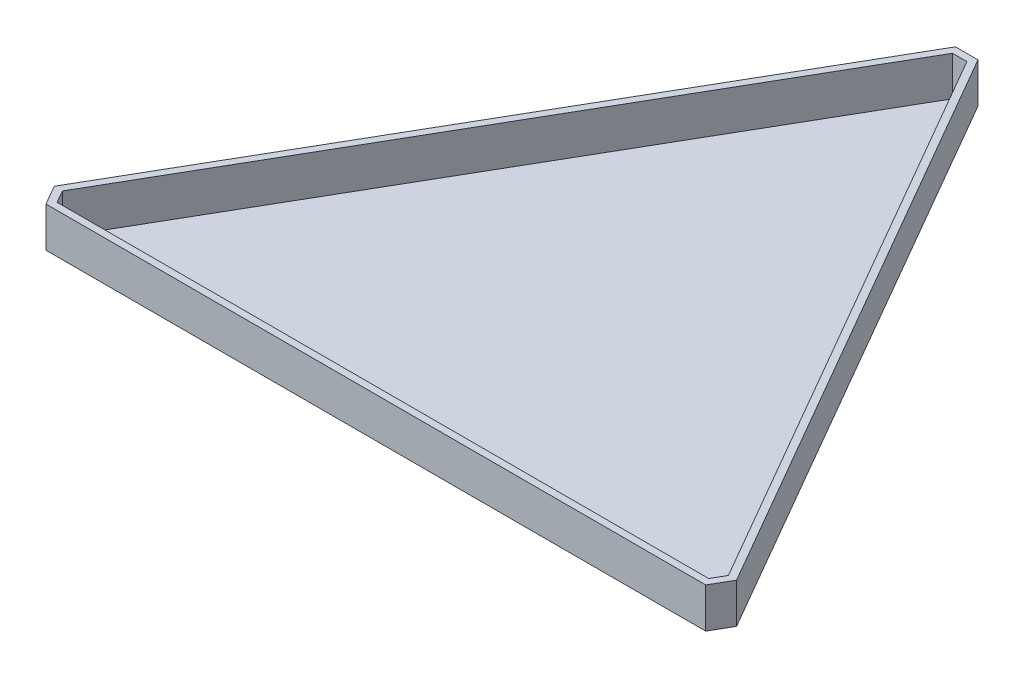
from build123d import *

# Parameters (mm, degrees)
BOSS_EXTRUDE6_DEPTH = 0.2
BOSS_EXTRUDE8_DEPTH = 14.2


with BuildPart() as part:
    # Sketch1 → Boss-Extrude6 (new body)
    with BuildSketch(Plane(origin=(0, 0, 0), x_dir=(1, 0, 0), z_dir=(0, 1, 0))):
        Polygon((231.716666588, -139.412373829), (462.829865412, -139.412373829), (465.38624875, -134.984588004), (349.829542096, 65.165499075), (344.716133219, 65.165499075), (229.159432538, -134.984249178), align=None)
    extrude(amount=BOSS_EXTRUDE6_DEPTH)

    # Sketch1<7> → Boss-Extrude8 (add)
    with BuildSketch(Plane(origin=(0, 0, 0), x_dir=(1, 0, 0), z_dir=(0, 1, 0))):
        Polygon((351.272917769, 67.665499075), (468.273000096, -134.984588004), (464.273241085, -141.912373829), (230.273290915, -141.912373829), (226.272682946, -134.984246139), (343.272757546, 67.665499075), align=None)
        Polygon((231.716666588, -139.412373829), (462.829865412, -139.412373829), (465.38624875, -134.984588004), (349.829542096, 65.165499075), (344.716133219, 65.165499075), (229.159432538, -134.984249178), align=None, mode=Mode.SUBTRACT)
    extrude(amount=BOSS_EXTRUDE8_DEPTH)


solid = part.part
